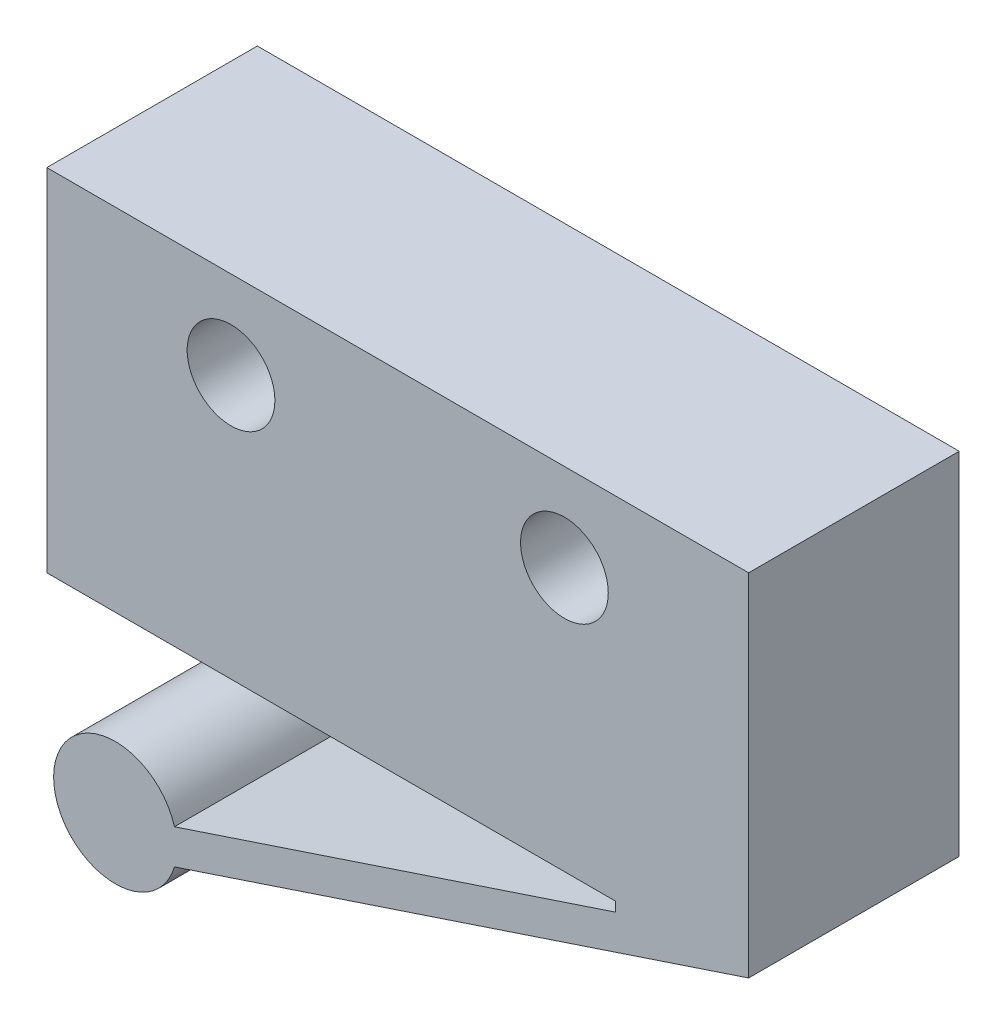
from build123d import *

# Parameters (mm, degrees)
ESQUISSE1_R        = 1.25
BOSS_EXTRU_1_DEPTH = 6


with BuildPart() as part:
    # Esquisse1 → Boss.-Extru.1 (new body)
    with BuildSketch(Plane.XY):
        with BuildLine():
            Line((14.75, 2.5), (-5.25, 2.5))
            Line((-5.25, 2.5), (-5.25, -7.5))
            Line((-5.25, -7.5), (10.956846109, -7.5))
            Line((10.956846109, -7.5), (10.956846109, -7.7709826))
            Line((10.956846109, -7.7709826), (-1.611734821, -11.948666512))
            ThreePointArc((-1.611734821, -11.948666512), (-5.055755597, -12.442812593), (-1.611966598, -12.938571387))
            Line((-1.611966598, -12.938571387), (14.75, -7.5))
            Line((14.75, -7.5), (14.75, 2.5))
        make_face()
        Circle(ESQUISSE1_R, mode=Mode.SUBTRACT)
        with Locations((9.5, 0)):
            Circle(ESQUISSE1_R, mode=Mode.SUBTRACT)
    extrude(amount=BOSS_EXTRU_1_DEPTH)


solid = part.part
